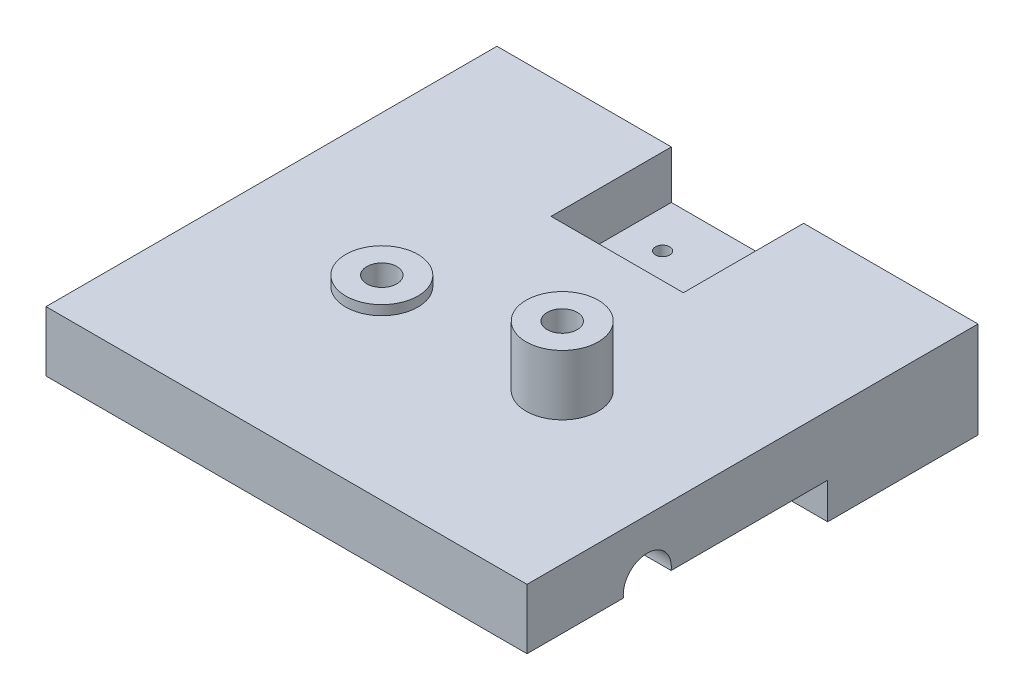
from build123d import *

# Parameters (mm, degrees)
SKETCH1_W               = 80
SKETCH1_H               = 50
BOSS_EXTRUDE1_DEPTH     = 10
SKETCH2_R               = 6.5
BOSS_EXTRUDE3_DEPTH     = 10
BOSS_EXTRUDE4_START     = 15
SKETCH3_R               = 6.5
BOSS_EXTRUDE4_DEPTH     = 15
SKETCH4_R               = 3.15
CUT_EXTRUDE1_DEPTH      = 40
SKETCH6_R               = 6
CUT_EXTRUDE3_DEPTH      = 9.75
CUT_EXTRUDE4_DEPTH      = 65.807406984
CUT_EXTRUDE4_DEPTH_BACK = 65.807406984
SKETCH14_R              = 4
SKETCH15_W              = 23.2
SKETCH15_H              = 10
SKETCH15_W_2            = 20.2
SKETCH15_H_2            = 6.8
BOSS_EXTRUDE5_DEPTH     = 15
SKETCH18_W              = 10
SKETCH18_H              = 10
BOSS_EXTRUDE6_DEPTH     = 80
BOSS_EXTRUDE8_START     = 15
SKETCH21_W              = 28.4
SKETCH21_H              = 16.534595494
SKETCH21_R              = 6.5
BOSS_EXTRUDE8_DEPTH     = 15
BOSS_EXTRUDE9_DEPTH     = 10
BOSS_EXTRUDE12_START    = 15
SKETCH23_W              = 28.4
SKETCH23_H              = 16.5
SKETCH23_R              = 3.15
BOSS_EXTRUDE12_DEPTH    = 15
BOSS_EXTRUDE13_DEPTH    = 10
SKETCH26_W              = 20.2
SKETCH26_H              = 6.8
BOSS_EXTRUDE15_DEPTH    = 15
CUT_EXTRUDE7_DEPTH      = 20
CUT_EXTRUDE8_DEPTH      = 16
SKETCH32_W              = 75
SKETCH32_H              = 2.556036438
CUT_EXTRUDE9_DEPTH      = 116.53
SKETCH38_R              = 1.185
CUT_EXTRUDE12_DEPTH     = 20
BOSS_EXTRUDE18_START    = -6
SKETCH39_W              = 23.2
SKETCH39_H              = 25
SKETCH39_R              = 1.185
SKETCH39_W_2            = 10
SKETCH39_H_2            = 4
BOSS_EXTRUDE18_DEPTH    = 6
SKETCH40_R              = 2.5
CUT_EXTRUDE13_DEPTH     = 20
SKETCH5_R               = 2.5
CUT_EXTRUDE14_DEPTH     = 77.25
BOSS_EXTRUDE20_START    = 10
SKETCH42_R              = 6
SKETCH42_R_2            = 2.5
BOSS_EXTRUDE20_DEPTH    = 10
BOSS_EXTRUDE21_START    = 1.6
SKETCH43_R              = 6
SKETCH43_R_2            = 2.5
BOSS_EXTRUDE21_DEPTH    = 1.6
BOSS_EXTRUDE22_START    = -10
SKETCH44_R              = 2.5
BOSS_EXTRUDE22_DEPTH    = 10
CUT_EXTRUDE15_DEPTH     = 2


with BuildPart() as part:
    # Sketch1 → Boss-Extrude1 (new body)
    with BuildSketch(Plane(origin=(0, 0, 0), x_dir=(1, 0, 0), z_dir=(0, 1, 0))):
        with Locations((40, -25)):
            Rectangle(SKETCH1_W, SKETCH1_H)
    extrude(amount=BOSS_EXTRUDE1_DEPTH)

    # Sketch2 → Boss-Extrude3 (add)
    with BuildSketch(Plane.XY):
        with Locations((14, 0)):
            Circle(SKETCH2_R)
        with Locations((66, 0)):
            Circle(SKETCH2_R)
    extrude(amount=BOSS_EXTRUDE3_DEPTH)

    # Sketch3 → Boss-Extrude4 (add)
    with BuildSketch(Plane(origin=(0, 0, 0), x_dir=(-1, 0, 0), z_dir=(0, 0, -1)).offset(BOSS_EXTRUDE4_START)):
        with Locations((-66, 0)):
            Circle(SKETCH3_R)
        with Locations((-14, 0)):
            Circle(SKETCH3_R)
    extrude(amount=-BOSS_EXTRUDE4_DEPTH)

    # Sketch4 → Cut-Extrude1 (cut)
    with BuildSketch(Plane(origin=(0, 0, -15), x_dir=(-1, 0, 0), z_dir=(0, 0, -1))):
        with Locations((-14, 0)):
            Circle(SKETCH4_R)
        with Locations((-66, 0)):
            Circle(SKETCH4_R)
    extrude(amount=-CUT_EXTRUDE1_DEPTH, mode=Mode.SUBTRACT)

    # Sketch6 → Cut-Extrude3 (cut, symmetric)
    with BuildSketch(Plane.ZY.offset(-40)):
        with Locations((40, 0.5)):
            Circle(SKETCH6_R)
    extrude(amount=CUT_EXTRUDE3_DEPTH, both=True, mode=Mode.SUBTRACT)

    # Sketch14 → Cut-Extrude4 (cut, two sides: drawn at the far end of the back side and taken through both)
    with BuildSketch(Plane.ZY.offset(-40).offset(-CUT_EXTRUDE4_DEPTH_BACK)):
        with Locations((40, 0.5)):
            Circle(SKETCH14_R)
    extrude(amount=CUT_EXTRUDE4_DEPTH + CUT_EXTRUDE4_DEPTH_BACK, mode=Mode.SUBTRACT)

    # Sketch15 → Boss-Extrude5 (add)
    with BuildSketch(Plane(origin=(0, 0, 0), x_dir=(-1, 0, 0), z_dir=(0, 0, -1))):
        with Locations((-40, 5)):
            Rectangle(SKETCH15_W, SKETCH15_H)
        with Locations((-40, 5)):
            Rectangle(SKETCH15_W_2, SKETCH15_H_2, mode=Mode.SUBTRACT)
    extrude(amount=BOSS_EXTRUDE5_DEPTH)

    # Sketch18 → Boss-Extrude6 (add)
    with BuildSketch(Plane.ZY):
        with Locations((55, 5)):
            Rectangle(SKETCH18_W, SKETCH18_H)
    extrude(amount=-BOSS_EXTRUDE6_DEPTH)

    # Sketch21 → Boss-Extrude8 (add)
    with BuildSketch(Plane(origin=(0, 0, 0), x_dir=(-1, 0, 0), z_dir=(0, 0, -1)).offset(BOSS_EXTRUDE8_START)):
        with Locations((-14.2, 1.732702253)):
            Rectangle(SKETCH21_W, SKETCH21_H)
        with Locations((-14, 0)):
            Circle(SKETCH21_R, mode=Mode.SUBTRACT)
    extrude(amount=-BOSS_EXTRUDE8_DEPTH)

    # Sketch22 → Boss-Extrude9 (add)
    with BuildSketch(Plane.XY):
        with BuildLine():
            Line((0, 0), (7.5, 0))
            ThreePointArc((7.5, 0), (14, -6.5), (20.5, 0))
            Line((20.5, 0), (28.4, 0))
            Line((28.4, 0), (28.4, -6.534595494))
            Line((28.4, -6.534595494), (0, -6.534595494))
            Line((0, -6.534595494), (0, 0))
        make_face()
    extrude(amount=BOSS_EXTRUDE9_DEPTH)

    # Sketch23 → Boss-Extrude12 (add)
    with BuildSketch(Plane(origin=(0, 0, 0), x_dir=(-1, 0, 0), z_dir=(0, 0, -1)).offset(BOSS_EXTRUDE12_START)):
        with Locations((-65.8, 1.75)):
            Rectangle(SKETCH23_W, SKETCH23_H)
        with Locations((-66, 0)):
            Circle(SKETCH23_R, mode=Mode.SUBTRACT)
    extrude(amount=-BOSS_EXTRUDE12_DEPTH)

    # Sketch24 → Boss-Extrude13 (add)
    with BuildSketch(Plane.XY):
        with BuildLine():
            ThreePointArc((72.5, 0), (70.596194078, -4.596194078), (66, -6.5))
            Line((66, -6.5), (80, -6.5))
            Line((80, -6.5), (80, 0))
            Line((80, 0), (72.5, 0))
        make_face()
        with BuildLine():
            Line((59.5, 0), (51.6, 0))
            Line((51.6, 0), (51.6, -6.5))
            Line((51.6, -6.5), (66, -6.5))
            ThreePointArc((66, -6.5), (61.403805922, -4.596194078), (59.5, 0))
        make_face()
    extrude(amount=BOSS_EXTRUDE13_DEPTH)

    # Sketch26 → Boss-Extrude15 (add)
    with BuildSketch(Plane(origin=(0, 0, 0), x_dir=(-1, 0, 0), z_dir=(0, 0, -1))):
        with Locations((-40, 5)):
            Rectangle(SKETCH26_W, SKETCH26_H)
    extrude(amount=BOSS_EXTRUDE15_DEPTH)

    # Sketch27 → Cut-Extrude7 (cut)
    with BuildSketch(Plane(origin=(0, 0, -15), x_dir=(-1, 0, 0), z_dir=(0, 0, -1))):
        Polygon((-51, 10), (-40, 10), (-29, 10), (-29, 2), (-51, 2), align=None)
    extrude(amount=-CUT_EXTRUDE7_DEPTH, mode=Mode.SUBTRACT)

    # Sketch30 → Cut-Extrude8 (cut)
    with BuildSketch(Plane(origin=(0, 2, 0), x_dir=(1, 0, 0), z_dir=(0, 1, 0))):
        Polygon((45, -5), (40, -5), (35, -5), (35, -1), (40, -1), (45, -1), align=None)
    extrude(amount=-CUT_EXTRUDE8_DEPTH, mode=Mode.SUBTRACT)

    # Sketch32 → Cut-Extrude9 (cut)
    with BuildSketch(Plane(origin=(80, 0, 0), x_dir=(0, 0, -1), z_dir=(1, 0, 0))):
        with Locations((-22.5, -7.278018219)):
            Rectangle(SKETCH32_W, SKETCH32_H)
    extrude(amount=-CUT_EXTRUDE9_DEPTH, mode=Mode.SUBTRACT)

    # Sketch38 → Cut-Extrude12 (cut)
    with BuildSketch(Plane(origin=(0, 2, 0), x_dir=(1, 0, 0), z_dir=(0, 1, 0))):
        with Locations((35.25, 7.3)):
            Circle(SKETCH38_R)
        with Locations((44.75, 7.3)):
            Circle(SKETCH38_R)
    extrude(amount=-CUT_EXTRUDE12_DEPTH, mode=Mode.SUBTRACT)

    # Sketch39 → Boss-Extrude18 (add)
    with BuildSketch(Plane.XZ.offset(6).offset(BOSS_EXTRUDE18_START)):
        with Locations((40, -2.5)):
            Rectangle(SKETCH39_W, SKETCH39_H)
        with Locations((35.25, -7.3)):
            Circle(SKETCH39_R, mode=Mode.SUBTRACT)
        with Locations((44.75, -7.3)):
            Circle(SKETCH39_R, mode=Mode.SUBTRACT)
        with Locations((40, 3)):
            Rectangle(SKETCH39_W_2, SKETCH39_H_2, mode=Mode.SUBTRACT)
    extrude(amount=BOSS_EXTRUDE18_DEPTH)

    # Sketch40 → Cut-Extrude13 (cut)
    with BuildSketch(Plane(origin=(0, 10, 0), x_dir=(1, 0, 0), z_dir=(0, 1, 0))):
        with Locations((25, -29.15)):
            Circle(SKETCH40_R)
        with Locations((55, -29.15)):
            Circle(SKETCH40_R)
    extrude(amount=-CUT_EXTRUDE13_DEPTH, mode=Mode.SUBTRACT)

    # Sketch5 → Cut-Extrude14 (cut)
    with BuildSketch(Plane.XZ):
        with Locations((25, 14)):
            Circle(SKETCH5_R)
        with Locations((55, 14)):
            Circle(SKETCH5_R)
    extrude(amount=-CUT_EXTRUDE14_DEPTH, mode=Mode.SUBTRACT)

    # Sketch42 → Boss-Extrude20 (add)
    with BuildSketch(Plane(origin=(0, 10, 0), x_dir=(1, 0, 0), z_dir=(0, 1, 0)).offset(BOSS_EXTRUDE20_START)):
        with Locations((55, -29.15)):
            Circle(SKETCH42_R)
        with Locations((55, -29.15)):
            Circle(SKETCH42_R_2, mode=Mode.SUBTRACT)
    extrude(amount=-BOSS_EXTRUDE20_DEPTH)

    # Sketch43 → Boss-Extrude21 (add)
    with BuildSketch(Plane(origin=(0, 10, 0), x_dir=(1, 0, 0), z_dir=(0, 1, 0)).offset(BOSS_EXTRUDE21_START)):
        with Locations((25, -29.15)):
            Circle(SKETCH43_R)
        with Locations((25, -29.15)):
            Circle(SKETCH43_R_2, mode=Mode.SUBTRACT)
    extrude(amount=-BOSS_EXTRUDE21_DEPTH)

    # Sketch44 → Boss-Extrude22 (add)
    with BuildSketch(Plane(origin=(0, 10, 0), x_dir=(1, 0, 0), z_dir=(0, 1, 0)).offset(BOSS_EXTRUDE22_START)):
        with Locations((25, -14)):
            Circle(SKETCH44_R)
        with Locations((55, -14)):
            Circle(SKETCH44_R)
    extrude(amount=BOSS_EXTRUDE22_DEPTH)

    # Sketch45 → Cut-Extrude15 (cut)
    # profile 1 of 2: a face of its own
    with BuildSketch(Plane.ZY):
        with BuildLine():
            Line((-12.541961952, -1.366127438), (-12.856064516, -1.366127438))
            add(Edge.make_bspline(
                [(-12.856064516, -1.366127438), (-12.854017363, -1.32445655), (-12.849996809, -1.242616035), (-12.83116852, -1.123292129), (-12.804227643, -1.00923733), (-12.766136189, -0.901367416), (-12.718829911, -0.798728609), (-12.662099884, -0.701728593), (-12.594906033, -0.610737405), (-12.518699299, -0.526598561), (-12.43593066, -0.449410991), (-12.346624721, -0.382755748), (-12.252779693, -0.326438076), (-12.154680294, -0.279356835), (-12.051219731, -0.244016989), (-11.943336873, -0.217795349), (-11.830557736, -0.202019003), (-11.753717714, -0.200323218), (-11.714638234, -0.199460771)],
                knots=[0, 0, 0, 0, 1.10065271, 2.161652631, 3.183658789, 4.190468796, 5.17591951, 6.163126047, 7.15150782, 8.156236427, 9.156009102, 10.134482811, 11.092018607, 12.041330605, 13.001268258, 13.972401359, 14.968799086, 16, 16, 16, 16], degree=3))
            add(Edge.make_bspline(
                [(-11.714638234, -0.199460771), (-11.67626016, -0.200359228), (-11.600848616, -0.202124662), (-11.490786601, -0.217285692), (-11.386009307, -0.241031283), (-11.28672154, -0.2743467), (-11.193715476, -0.319131127), (-11.106292431, -0.372928666), (-11.02341162, -0.435148497), (-10.948804837, -0.50840231), (-10.880296757, -0.586604695), (-10.821194502, -0.670092598), (-10.770581339, -0.756321884), (-10.728393659, -0.845950086), (-10.69733752, -0.939821114), (-10.673759312, -1.036568317), (-10.660431898, -1.137193128), (-10.658386475, -1.205299684), (-10.657346568, -1.239925515)],
                knots=[0, 0, 0, 0, 1.111607364, 2.184268762, 3.212621178, 4.221274766, 5.211760367, 6.196651075, 7.1921475, 8.207485113, 9.220403448, 10.201281604, 11.166441695, 12.114753415, 13.065576456, 14.026450734, 14.996634279, 16, 16, 16, 16], degree=3))
            add(Edge.make_bspline(
                [(-10.657346568, -1.239925515), (-10.65903983, -1.288673349), (-10.662396642, -1.385313563), (-10.691111018, -1.527328426), (-10.735957529, -1.664921845), (-10.789954886, -1.775659147), (-10.84442733, -1.864892641), (-10.893514838, -1.938361345), (-10.950979649, -2.017466814), (-11.017658147, -2.101944151), (-11.092171019, -2.192455056), (-11.175193182, -2.288944852), (-11.267316664, -2.390416622), (-11.331975165, -2.459722223), (-11.36547958, -2.495634649)],
                knots=[0, 0, 0, 0, 1.184426356, 2.348067706, 3.509069118, 4.696110526, 5.333549288, 6.050745305, 6.844228056, 7.710549037, 8.667450064, 9.695053472, 10.805634456, 12, 12, 12, 12], degree=3))
            Line((-11.36547958, -2.495634649), (-12.241180702, -3.430230002))
            Line((-12.241180702, -3.430230002), (-10.612474773, -3.430230002))
            Line((-10.612474773, -3.430230002), (-10.612474773, -3.789204361))
            Line((-10.612474773, -3.789204361), (-12.990679901, -3.789204361))
            Line((-12.990679901, -3.789204361), (-11.633308106, -2.340686733))
            add(Edge.make_bspline(
                [(-11.633308106, -2.340686733), (-11.600260219, -2.306188426), (-11.536781992, -2.239924239), (-11.446999415, -2.143181279), (-11.366360427, -2.053431739), (-11.294343034, -1.97084519), (-11.232509529, -1.894213622), (-11.177637297, -1.826018919), (-11.133671706, -1.763264468), (-11.08595631, -1.690523855), (-11.039742329, -1.601711537), (-11.000029973, -1.493177848), (-10.975815124, -1.381450595), (-10.972910289, -1.305948558), (-10.971449132, -1.267970386)],
                knots=[0, 0, 0, 0, 1.329631726, 2.553950428, 3.673215718, 4.687767853, 5.603093632, 6.413772471, 7.123043292, 7.734684054, 8.834405432, 9.900288307, 10.943827018, 12, 12, 12, 12], degree=3))
            add(Edge.make_bspline(
                [(-10.971449132, -1.267970386), (-10.972084874, -1.244088988), (-10.9733378, -1.197023338), (-10.984395497, -1.128017579), (-11.001106004, -1.061452765), (-11.025051262, -0.997124146), (-11.056658002, -0.935678494), (-11.095131382, -0.877041013), (-11.139521445, -0.820352048), (-11.190872714, -0.76719875), (-11.247284234, -0.718517545), (-11.306878484, -0.675393459), (-11.369928588, -0.639354348), (-11.43616871, -0.609810851), (-11.50541418, -0.58663547), (-11.577798925, -0.570576891), (-11.653122941, -0.560494407), (-11.704556437, -0.559130235), (-11.730764036, -0.55843513)],
                knots=[0, 0, 0, 0, 0.991446411, 1.95395049, 2.89581595, 3.838931463, 4.798493298, 5.75982156, 6.748411868, 7.785213223, 8.824556874, 9.840280684, 10.836137867, 11.835679398, 12.848801643, 13.863922112, 14.911575587, 16, 16, 16, 16], degree=3))
            add(Edge.make_bspline(
                [(-11.730764036, -0.55843513), (-11.758134868, -0.559150162), (-11.811886665, -0.560554368), (-11.890805697, -0.570377032), (-11.966091475, -0.587322872), (-12.037933378, -0.610499546), (-12.106452964, -0.639958095), (-12.171317008, -0.67664984), (-12.232379897, -0.720433333), (-12.28975642, -0.770073889), (-12.342620399, -0.825341491), (-12.389067275, -0.886951454), (-12.429651289, -0.953778869), (-12.465060523, -1.02564342), (-12.493816213, -1.1031972), (-12.515789363, -1.186164904), (-12.53317621, -1.274186286), (-12.538984731, -1.334971371), (-12.541961952, -1.366127438)],
                knots=[0, 0, 0, 0, 1.031018746, 2.02475058, 2.990194455, 3.934040569, 4.864654155, 5.795059489, 6.735614925, 7.690564532, 8.649604399, 9.611025574, 10.590972636, 11.591080095, 12.624614302, 13.701020113, 14.821632451, 16, 16, 16, 16], degree=3))
        make_face()
    # profile 2 of 2: a face of its own
    with BuildSketch(Plane.ZY):
        with BuildLine():
            Line((-9.535551696, -3.878947951), (-9.786553298, -3.704368624))
            Line((-9.786553298, -3.704368624), (-8.813396247, -2.281792502))
            add(Edge.make_bspline(
                [(-8.813396247, -2.281792502), (-8.875486983, -2.289385565), (-8.997747103, -2.30433673), (-9.120884205, -2.307083385), (-9.181485189, -2.30843513)],
                knots=[0, 0, 0, 0, 1.015715272, 2, 2, 2, 2], degree=3))
            add(Edge.make_bspline(
                [(-9.181485189, -2.30843513), (-9.218227237, -2.307494054), (-9.290348664, -2.305646803), (-9.396380317, -2.291004994), (-9.498265877, -2.268454867), (-9.595735233, -2.234806112), (-9.689154738, -2.192987903), (-9.778320451, -2.141130889), (-9.863112342, -2.080124597), (-9.942619752, -2.010291606), (-10.014931491, -1.933613553), (-10.079354788, -1.85245791), (-10.13289592, -1.76588194), (-10.177372506, -1.67565172), (-10.211102959, -1.580470369), (-10.235665497, -1.481420969), (-10.250787851, -1.377809327), (-10.252586947, -1.307284197), (-10.253500414, -1.271475995)],
                knots=[0, 0, 0, 0, 1.060718605, 2.082097864, 3.085795603, 4.069760067, 5.054557537, 6.03741023, 7.043284206, 8.066802108, 9.088538119, 10.083643548, 11.053783639, 12.022749082, 12.983451788, 13.964007469, 14.966251758, 16, 16, 16, 16], degree=3))
            add(Edge.make_bspline(
                [(-10.253500414, -1.271475995), (-10.251765979, -1.222507343), (-10.248361635, -1.126391811), (-10.220963118, -0.985958042), (-10.175902779, -0.853171499), (-10.113074402, -0.728381305), (-10.033939681, -0.613382565), (-9.938831091, -0.509773956), (-9.828327126, -0.419029102), (-9.704945107, -0.341025025), (-9.571592086, -0.278290028), (-9.431923428, -0.232050727), (-9.287009308, -0.204851979), (-9.188841638, -0.201266118), (-9.139417882, -0.199460771)],
                knots=[0, 0, 0, 0, 1.022988612, 2.007919123, 2.978103895, 3.94594894, 4.918897164, 5.887013414, 6.875921846, 7.89917871, 8.930658928, 9.948724884, 10.967259574, 12, 12, 12, 12], degree=3))
            add(Edge.make_bspline(
                [(-9.139417882, -0.199460771), (-9.090929462, -0.201290934), (-8.995120915, -0.204907164), (-8.854231909, -0.231391133), (-8.719290892, -0.276027806), (-8.591045905, -0.337712369), (-8.472306493, -0.415033277), (-8.365530682, -0.507167801), (-8.273155143, -0.614173328), (-8.195331262, -0.733461818), (-8.132861222, -0.861628799), (-8.087788939, -0.995412722), (-8.0600433, -1.133851443), (-8.056546972, -1.227645917), (-8.054782465, -1.274981604)],
                knots=[0, 0, 0, 0, 1.026385292, 2.028040595, 3.023318987, 4.028184125, 5.03290303, 6.015178782, 7.004435299, 8.016004309, 9.023023918, 10.015172535, 10.998308025, 12, 12, 12, 12], degree=3))
            add(Edge.make_bspline(
                [(-8.054782465, -1.274981604), (-8.055960874, -1.311725372), (-8.058350982, -1.386250912), (-8.075087289, -1.499481255), (-8.103507474, -1.614932485), (-8.135759173, -1.71265408), (-8.16689134, -1.79336253), (-8.196192472, -1.85711411), (-8.228704626, -1.924215373), (-8.266623391, -1.993962711), (-8.307385688, -2.067245246), (-8.353444964, -2.143327962), (-8.403750536, -2.222312955), (-8.439580256, -2.275560043), (-8.457927497, -2.302826156)],
                knots=[0, 0, 0, 0, 1.179839688, 2.393009684, 3.667231171, 4.993948276, 5.694988576, 6.444077775, 7.246288328, 8.089075292, 8.993003841, 9.939041771, 10.944649915, 12, 12, 12, 12], degree=3))
            Line((-8.457927497, -2.302826156), (-9.535551696, -3.878947951))
        make_face()
        with BuildLine():
            add(Edge.make_bspline(
                [(-9.12329208, -1.949460771), (-9.095458066, -1.948700387), (-9.041274703, -1.947220179), (-8.961897404, -1.938210937), (-8.886973201, -1.922236951), (-8.816301951, -1.899317239), (-8.74917505, -1.87166057), (-8.686658721, -1.836448584), (-8.628700646, -1.794431949), (-8.574912719, -1.747221933), (-8.527148719, -1.694771349), (-8.484605689, -1.639874243), (-8.448445121, -1.582289633), (-8.419881844, -1.521296371), (-8.396397269, -1.458379162), (-8.380179257, -1.392524807), (-8.371194923, -1.324076406), (-8.369663348, -1.277577748), (-8.368885029, -1.253947951)],
                knots=[0, 0, 0, 0, 1.163407946, 2.26475976, 3.333800367, 4.359385343, 5.366239384, 6.363380779, 7.350133999, 8.353570782, 9.349036268, 10.310270964, 11.253520213, 12.184142, 13.120487599, 14.056272588, 15.012232024, 16, 16, 16, 16], degree=3))
            add(Edge.make_bspline(
                [(-8.368885029, -1.253947951), (-8.369554698, -1.230308285), (-8.370874364, -1.183723425), (-8.381461663, -1.115173685), (-8.400086886, -1.049480425), (-8.425077371, -0.986283995), (-8.457997609, -0.926103623), (-8.497501095, -0.868183751), (-8.544433544, -0.812891623), (-8.598436111, -0.76152764), (-8.656670664, -0.71417974), (-8.718731164, -0.672393664), (-8.78410608, -0.637372468), (-8.85239657, -0.608473498), (-8.923744919, -0.585921723), (-8.998108907, -0.569704358), (-9.075864312, -0.560732603), (-9.128645599, -0.559210709), (-9.155543683, -0.55843513)],
                knots=[0, 0, 0, 0, 0.972161553, 1.915763587, 2.844109794, 3.775983486, 4.705125789, 5.659731448, 6.655561913, 7.682237399, 8.721216875, 9.739758359, 10.754845918, 11.767244016, 12.7857855, 13.828538656, 14.893392813, 16, 16, 16, 16], degree=3))
            add(Edge.make_bspline(
                [(-9.155543683, -0.55843513), (-9.182207836, -0.559211962), (-9.234522686, -0.560736099), (-9.311586845, -0.569687304), (-9.385448013, -0.586030788), (-9.456589633, -0.608463052), (-9.524878094, -0.637374624), (-9.590249927, -0.6723955), (-9.652324943, -0.714170122), (-9.710503664, -0.761564894), (-9.764601586, -0.81265254), (-9.810727115, -0.868425969), (-9.850321007, -0.926073494), (-9.88319601, -0.986292002), (-9.908198527, -1.049478288), (-9.926820529, -1.115174264), (-9.937408694, -1.183723274), (-9.938728241, -1.230308235), (-9.93939785, -1.253947951)],
                knots=[0, 0, 0, 0, 1.099389452, 2.15699305, 3.192601482, 4.213358962, 5.227959689, 6.245255729, 7.266013209, 8.307253147, 9.336162325, 10.327954924, 11.284637477, 12.215801273, 13.149702402, 14.080068371, 15.025723358, 16, 16, 16, 16], degree=3))
            add(Edge.make_bspline(
                [(-9.93939785, -1.253947951), (-9.938791924, -1.277596149), (-9.937596926, -1.324234725), (-9.926069137, -1.392761118), (-9.906790857, -1.458449312), (-9.880971466, -1.521938019), (-9.846969876, -1.582609877), (-9.805246028, -1.640177239), (-9.756340482, -1.69529269), (-9.700906994, -1.747099901), (-9.640238833, -1.794652077), (-9.575442087, -1.836182459), (-9.50763225, -1.871254903), (-9.43657062, -1.899396287), (-9.36278382, -1.922007951), (-9.285608688, -1.938181496), (-9.205300451, -1.947133763), (-9.150890469, -1.94867766), (-9.12329208, -1.949460771)],
                knots=[0, 0, 0, 0, 0.952633368, 1.87876736, 2.791047057, 3.707742249, 4.635551637, 5.587206343, 6.568248508, 7.601284464, 8.641511608, 9.671105535, 10.699146789, 11.713763218, 12.747829548, 13.806491675, 14.887386225, 16, 16, 16, 16], degree=3))
        make_face(mode=Mode.SUBTRACT)
    extrude(amount=-CUT_EXTRUDE15_DEPTH, mode=Mode.SUBTRACT)


solid = part.part
